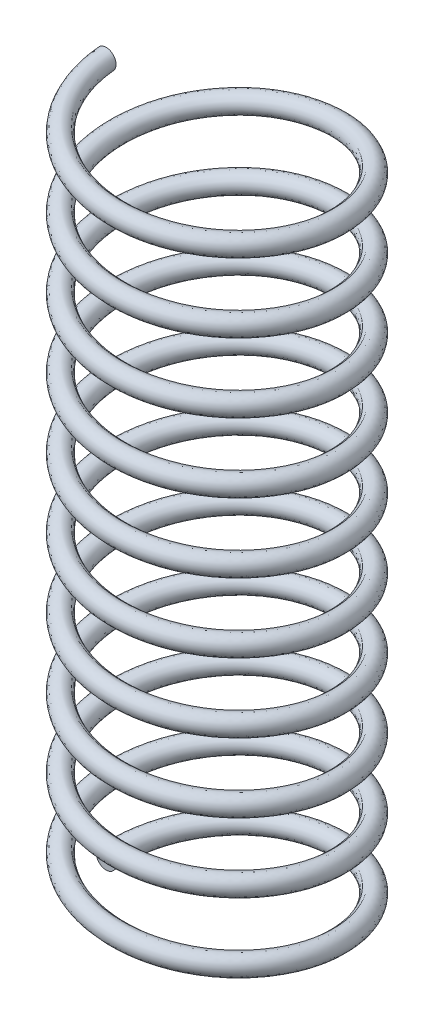
from build123d import *

# Parameters (mm, degrees)
SWEEP1_PITCH       = 1.75
SWEEP1_HEIGHT      = 17.5
SWEEP1_RADIUS      = 2.8
SWEEP1_START_ANGLE = -90
SKETCH2_R          = 0.25


with BuildPart() as part:
    # Sweep1: sweep along a helix
    with BuildLine() as sweep1_path:
        add(Helix(SWEEP1_PITCH, SWEEP1_HEIGHT, SWEEP1_RADIUS, center=(0, 0, 0), direction=(0, 1, 0), lefthand=True, mode=Mode.PRIVATE).rotate(Axis((0, 0, 0), (0, 1, 0)), SWEEP1_START_ANGLE))
    # Sketch2 → Sweep1 (sweep)
    with BuildSketch(Plane.XY):
        with Locations((-2.8, 0)):
            Circle(SKETCH2_R)
    sweep(path=sweep1_path.line, is_frenet=True)


solid = part.part
